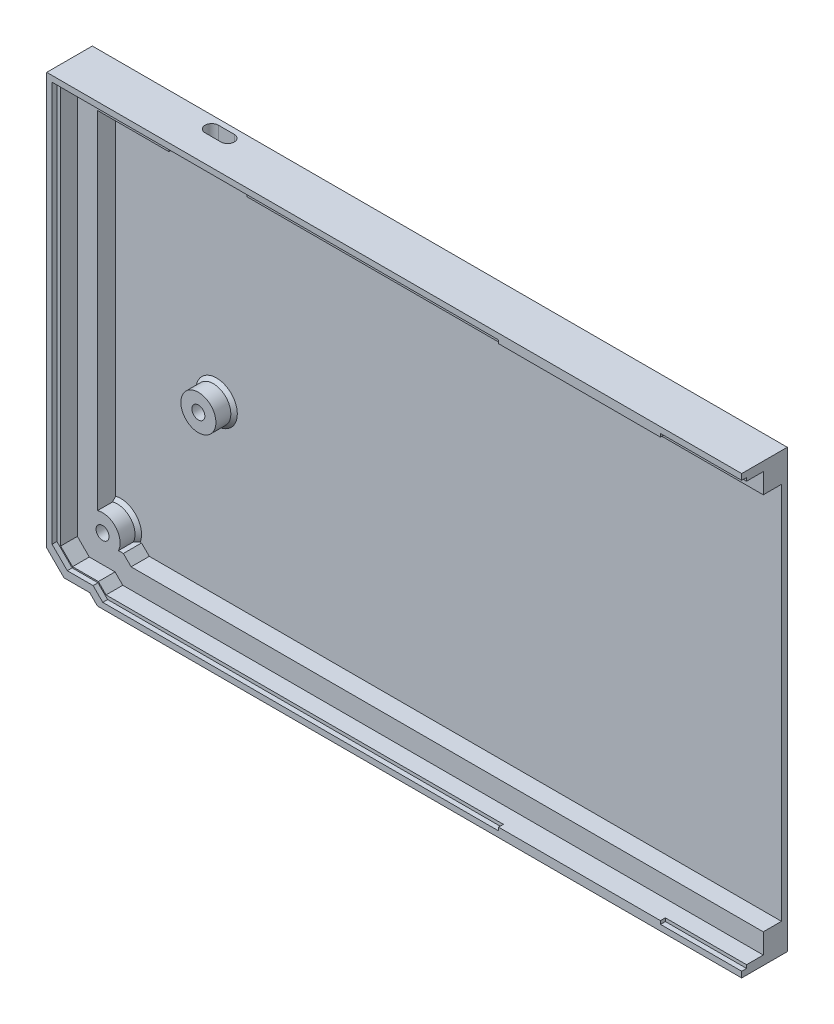
from build123d import *

# Parameters (mm, degrees)
P_IDAT_VYSUNUT_M1_DEPTH  = 5.6
SKO_EPINA1_T             = 1.8
P_IDAT_VYSUNUT_M3_DEPTH  = 5.15
P_IDAT_VYSUNUT_M4_DEPTH  = 7.4
P_IDAT_VYSUNUT_M5_DEPTH  = 1.5
SKICA14_W                = 49.9
SKICA14_H                = 0.995009232
P_IDAT_VYSUNUT_M6_DEPTH  = 1.5
SKICA15_R                = 5.4
SKICA15_W                = 3
SKICA15_H                = 9
P_IDAT_VYSUNUT_M7_DEPTH  = 5.6
SKICA16_R                = 2
ODEBRAT_VYSUNUT_M1_DEPTH = 5.75
ZKOSEN_1_SIZE            = 1
SKICA17_W                = 24
SKICA17_H                = 13.4
ODEBRAT_VYSUNUT_M2_DEPTH = 1.6
ODEBRAT_VYSUNUT_M3_REACH = 442.031
SKICA23_R                = 2
ODEBRAT_VYSUNUT_M4_DEPTH = 5.7
SKICA24_R                = 2
ODEBRAT_VYSUNUT_M5_DEPTH = 5.7
SKICA25_R                = 6.25
ODEBRAT_VYSUNUT_M6_DEPTH = 1.5
SKICA26_W                = 214.140084969
SKICA26_H                = 14.05
ODEBRAT_VYSUNUT_M7_DEPTH = 443.82576223


with BuildPart() as part:
    # Skica3 → Přidat vysunutím1 (new body)
    with BuildSketch(Plane.XY):
        Polygon((2.412545276, -4), (412.692715215, -4), (412.692715215, -118.191389918), (412.654731358, -118.229366948), (404.717731358, -118.229366948), (402.336688893, -120.609981536), (12.768122748, -120.609981536), (10.387229089, -118.22921813), (2.450229089, -118.22921813), (2.412545276, -118.191536378), align=None)
    extrude(amount=P_IDAT_VYSUNUT_M1_DEPTH)

    # Skořepina1
    sko_epina1_openings = [part.faces().sort_by_distance(p)[0] for p in [
        (207.552632266, -62.25279763, 5.6),
    ]]
    offset(amount=SKO_EPINA1_T, openings=sko_epina1_openings, kind=Kind.INTERSECTION)



with BuildPart() as body_2:
    # Skica7 → Přidat vysunutím3 (new body)
    with BuildSketch(Plane.XY.offset(5.6)):
        Polygon((-6.587454724, 5), (-6.587454724, -121.919602656), (-1.277548758, -127.22921813), (6.659451242, -127.22921813), (9.040344901, -129.609981536), (406.06413722, -129.609981536), (408.445179685, -127.229366948), (416.382179685, -127.229366948), (421.692715215, -121.919785731), (421.692715215, 5), align=None)
        Polygon((-3.787454724, 2.2), (-3.787454724, -120.759759814), (-0.11779565, -124.42921813), (7.81920435, -124.42921813), (10.200098009, -126.809981536), (404.904486629, -126.809981536), (407.285529094, -124.429366948), (415.222529094, -124.429366948), (418.892715215, -120.759840367), (418.892715215, 2.2), align=None, mode=Mode.SUBTRACT)
    extrude(amount=P_IDAT_VYSUNUT_M3_DEPTH)


with BuildPart() as part_1:
    add(part.part)

    add(body_2.part)  # Přidat vysunutím4 merges body 2
    # Skica8 → Přidat vysunutím4 (add)
    with BuildSketch(Plane(origin=(0, 0, 5.6), x_dir=(-1, 0, 0), z_dir=(0, 0, -1))):
        Polygon((-421.692715215, 5), (6.587454724, 5), (6.587454724, -121.919602656), (1.277548758, -127.22921813), (-6.659451242, -127.22921813), (-9.040344901, -129.609981536), (-406.06413722, -129.609981536), (-408.445179685, -127.229366948), (-416.382179685, -127.229366948), (-421.692715215, -121.919785731), align=None)
        Polygon((-0.612545276, -2.2), (-0.612545276, -118.937149634), (-1.70467352, -120.02921813), (-9.64167352, -120.02921813), (-12.022567179, -122.409981536), (-403.082178558, -122.409981536), (-405.463221024, -120.029366948), (-413.400221024, -120.029366948), (-414.492715215, -118.93706908), (-414.492715215, -2.2), align=None, mode=Mode.SUBTRACT)
    extrude(amount=P_IDAT_VYSUNUT_M4_DEPTH)

    # Skica11 → Přidat vysunutím5 (add)
    with BuildSketch(Plane.XY.offset(10.75)):
        Polygon((421.692715215, 5), (-6.587454724, 5), (-6.587454724, -121.919602656), (-1.277548758, -127.22921813), (6.659451242, -127.22921813), (9.040344901, -129.609981536), (406.06413722, -129.609981536), (408.445179685, -127.229366948), (416.382179685, -127.229366948), (421.692715215, -121.919785731), align=None)
        Polygon((420.052630246, 3.195009232), (-4.947369754, 3.195009232), (-4.947369754, -120.114611888), (-0.239981646, -124.821742467), (7.697018354, -124.821742467), (10.68042987, -127.804990768), (404.42405225, -127.804990768), (406.805094715, -125.424376181), (414.742094715, -125.424376181), (420.052630246, -120.114794964), align=None, mode=Mode.SUBTRACT)
    extrude(amount=P_IDAT_VYSUNUT_M5_DEPTH)

    # Skica14 → Přidat vysunutím6 (add)
    with BuildSketch(Plane.XY.offset(10.75)):
        with Locations((157.582630246, 2.697504616)):
            Rectangle(SKICA14_W, SKICA14_H)
        with Locations((257.522630246, 2.697504616)):
            Rectangle(SKICA14_W, SKICA14_H)
        with Locations((257.52224106, -127.307486152)):
            Rectangle(SKICA14_W, SKICA14_H)
        with Locations((157.58224106, -127.307486152)):
            Rectangle(SKICA14_W, SKICA14_H)
    extrude(amount=P_IDAT_VYSUNUT_M6_DEPTH)

    # Skica15 → Přidat vysunutím7 (add)
    with BuildSketch(Plane.XY):
        with Locations((3.968545276, -115.95421813)):
            Circle(SKICA15_R)
        with Locations((33.491545276, -69.050981536)):
            Circle(SKICA15_R)
        with Locations((411.197715215, -115.879366948)):
            Circle(SKICA15_R)
        with Locations((334.147715215, -53.972)):
            Circle(SKICA15_R)
        with Locations((36.401545276, 0)):
            Rectangle(SKICA15_W, SKICA15_H)
    extrude(amount=P_IDAT_VYSUNUT_M7_DEPTH)

    # Skica16 → Odebrat vysunutím1 (cut)
    with BuildSketch(Plane.XY.offset(5.6)):
        with Locations((3.968545276, -115.95421813)):
            Circle(SKICA16_R)
        with Locations((33.491545276, -69.050981536)):
            Circle(SKICA16_R)
        with Locations((334.147715215, -53.972)):
            Circle(SKICA16_R)
        with Locations((411.197715215, -115.879366948)):
            Circle(SKICA16_R)
    extrude(amount=-ODEBRAT_VYSUNUT_M1_DEPTH, mode=Mode.SUBTRACT)

    # Zkosení1
    zkosen_1_edges = [part_1.edges().sort_by_distance(p)[0] for p in [
        (8.049207709, -112.417525591, 0),
        (28.091545276, -69.050981536, 0),
        (407.069426922, -112.398384936, 0),
        (328.747715215, -53.972, 0),
    ]]
    chamfer(zkosen_1_edges, length=ZKOSEN_1_SIZE)

    # Skica17 → Odebrat vysunutím2 (cut)
    with BuildSketch(Plane.XY.offset(5.6)):
        with Locations((36.401545276, -4.5)):
            Rectangle(SKICA17_W, SKICA17_H)
    extrude(amount=-ODEBRAT_VYSUNUT_M2_DEPTH, mode=Mode.SUBTRACT)

    # Odebrat vysunutím3: up to this face of the body (flat: up to its plane)
    odebrat_vysunut_m3_end = Plane(part_1.part.faces().sort_by_distance((207.552630246, 5, 5.225))[0])
    # Skica18 → Odebrat vysunutím3 (cut, up to the picked face)
    with BuildSketch(Plane.XZ.offset(4.5), mode=Mode.PRIVATE) as odebrat_vysunut_m3_sk1:
        with BuildLine():
            Line((33.951545276, 4), (38.851545276, 4))
            ThreePointArc((38.851545276, 4), (40.901545276, 1.95), (38.851545276, -0.1))
            Line((38.851545276, -0.1), (33.951545276, -0.1))
            ThreePointArc((33.951545276, -0.1), (31.901545276, 1.95), (33.951545276, 4))
        make_face()
    odebrat_vysunut_m3_tool1 = split(extrude(odebrat_vysunut_m3_sk1.sketch, amount=-ODEBRAT_VYSUNUT_M3_REACH, mode=Mode.PRIVATE), bisect_by=odebrat_vysunut_m3_end, keep=Keep.BOTH, mode=Mode.PRIVATE)
    add(odebrat_vysunut_m3_tool1.solids().sort_by(Axis((36.401545, -4.5, 1.95), (0, 1, 0)))[0], mode=Mode.SUBTRACT)

    # Skica23 → Odebrat vysunutím4 (cut)
    with BuildSketch(Plane.ZY.offset(6.587454724)):
        with Locations((3.2, -18.459801328)):
            Circle(SKICA23_R)
        with Locations((3.2, -98.459801328)):
            Circle(SKICA23_R)
    extrude(amount=-ODEBRAT_VYSUNUT_M4_DEPTH, mode=Mode.SUBTRACT)

    # Skica24 → Odebrat vysunutím5 (cut)
    with BuildSketch(Plane(origin=(421.692715215, 0, 0), x_dir=(0, 0, -1), z_dir=(1, 0, 0))):
        with Locations((-3.2, -18.459892866)):
            Circle(SKICA24_R)
        with Locations((-3.2, -98.459892866)):
            Circle(SKICA24_R)
    extrude(amount=-ODEBRAT_VYSUNUT_M5_DEPTH, mode=Mode.SUBTRACT)

    # Skica25 → Odebrat vysunutím6 (cut)
    with BuildSketch(Plane(origin=(0, 0, -1.8), x_dir=(-1, 0, 0), z_dir=(0, 0, -1))):
        with Locations((-401.692715215, -15)):
            Circle(SKICA25_R)
        with Locations((-13.412545276, -15)):
            Circle(SKICA25_R)
        with Locations((-388.445179685, -109.609981536)):
            Circle(SKICA25_R)
        with Locations((-26.659451242, -109.609981536)):
            Circle(SKICA25_R)
    extrude(amount=-ODEBRAT_VYSUNUT_M6_DEPTH, mode=Mode.SUBTRACT)

    # Skica26 → Odebrat vysunutím7 (cut, through all)
    with BuildSketch(Plane(origin=(0, 5, 0), x_dir=(1, 0, 0), z_dir=(0, 1, 0))):
        with Locations((314.622672731, -5.225)):
            Rectangle(SKICA26_W, SKICA26_H)
    extrude(amount=-ODEBRAT_VYSUNUT_M7_DEPTH, mode=Mode.SUBTRACT)


solid = part_1.part
